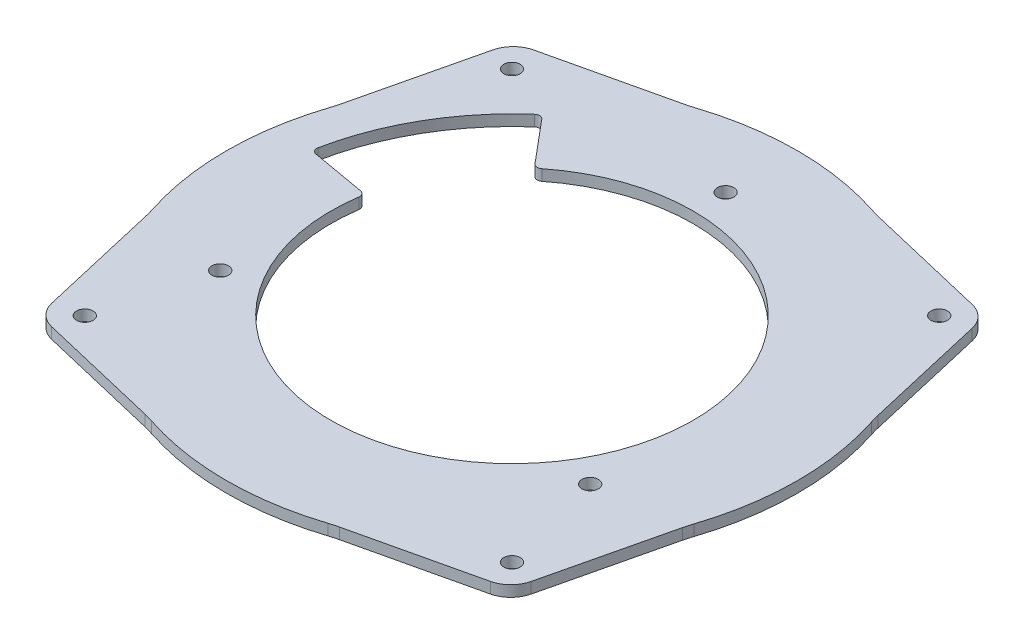
from build123d import *

# Parameters (mm, degrees)
SKETCH2_R           = 1.5
SKETCH2_R_2         = 33
BOSS_EXTRUDE1_DEPTH = 2
CUT_EXTRUDE1_DEPTH  = 74.566296631
FILLET1_R           = 1


with BuildPart() as part:
    # Sketch2 → Boss-Extrude1 (new body)
    with BuildSketch(Plane(origin=(0, 0, 0), x_dir=(1, 0, 0), z_dir=(0, 1, 0))):
        with BuildLine():
            Line((17.897079586, 48.929734976), (40.149284407, 43.651218265))
            ThreePointArc((40.149284407, 43.651218265), (42.540265174, 42.312242187), (43.866371506, 39.91409958))
            Line((43.866371506, 39.91409958), (49.02521675, 17.633846579))
            ThreePointArc((49.02521675, 17.633846579), (49.23478351, 16.809026698), (49.479249782, 15.993868858))
            ThreePointArc((49.479249782, 15.993868858), (51.999812242, -0.139738387), (49.392575566, -16.259565766))
            ThreePointArc((49.392575566, -16.259565766), (49.143731732, -17.073397941), (48.929734976, -17.897079586))
            Line((48.929734976, -17.897079586), (43.651218265, -40.149284407))
            ThreePointArc((43.651218265, -40.149284407), (42.312242187, -42.540265174), (39.91409958, -43.866371506))
            Line((39.91409958, -43.866371506), (17.633846579, -49.02521675))
            ThreePointArc((17.633846579, -49.02521675), (16.809026698, -49.23478351), (15.993868858, -49.479249782))
            ThreePointArc((15.993868858, -49.479249782), (-0.139738387, -51.999812242), (-16.259565766, -49.392575566))
            ThreePointArc((-16.259565766, -49.392575566), (-17.073397941, -49.143731732), (-17.897079586, -48.929734976))
            Line((-17.897079586, -48.929734976), (-40.149284407, -43.651218265))
            ThreePointArc((-40.149284407, -43.651218265), (-42.540265174, -42.312242187), (-43.866371506, -39.91409958))
            Line((-43.866371506, -39.91409958), (-49.02521675, -17.633846579))
            ThreePointArc((-49.02521675, -17.633846579), (-49.23478351, -16.809026698), (-49.479249782, -15.993868858))
            ThreePointArc((-49.479249782, -15.993868858), (-51.999812242, 0.139738387), (-49.392575566, 16.259565766))
            ThreePointArc((-49.392575566, 16.259565766), (-49.143731732, 17.073397941), (-48.929734976, 17.897079586))
            Line((-48.929734976, 17.897079586), (-43.651218265, 40.149284407))
            ThreePointArc((-43.651218265, 40.149284407), (-42.312242187, 42.540265174), (-39.91409958, 43.866371506))
            Line((-39.91409958, 43.866371506), (-17.633846579, 49.02521675))
            ThreePointArc((-17.633846579, 49.02521675), (-16.809026698, 49.23478351), (-15.993868858, 49.479249782))
            ThreePointArc((-15.993868858, 49.479249782), (-8.026622704, 51.3767781), (0.139738387, 51.999812242))
            ThreePointArc((0.139738387, 51.999812242), (8.302633013, 51.332896714), (16.259565766, 49.392575566))
            ThreePointArc((16.259565766, 49.392575566), (17.073397941, 49.143731732), (17.897079586, 48.929734976))
        make_face()
        with Locations(Location((-38.8907, 38.8907, 0), (0, 0, 270))):
            Circle(SKETCH2_R, mode=Mode.SUBTRACT)
        with Locations(Location((38.8907, 38.8907, 0), (0, 0, 90))):
            Circle(SKETCH2_R, mode=Mode.SUBTRACT)
        with Locations(Location((38.8907, -38.8907, 0), (0, 0, 270))):
            Circle(SKETCH2_R, mode=Mode.SUBTRACT)
        with Locations(Location((-38.8907, -38.8907, 0), (0, 0, 90))):
            Circle(SKETCH2_R, mode=Mode.SUBTRACT)
        with Locations(Location((0, 0, 0), (0, 0, 270))):
            Circle(SKETCH2_R_2, mode=Mode.SUBTRACT)
        with Locations(Location((0, 38.8907, 0), (0, 0, 270))):
            Circle(SKETCH2_R, mode=Mode.SUBTRACT)
        with Locations(Location((-33.680334171, -19.44535, 0), (0, 0, 270))):
            Circle(SKETCH2_R, mode=Mode.SUBTRACT)
        with Locations(Location((33.680334171, -19.44535, 0), (0, 0, 270))):
            Circle(SKETCH2_R, mode=Mode.SUBTRACT)
    extrude(amount=BOSS_EXTRUDE1_DEPTH)

    # Sketch3 → Cut-Extrude1 (cut, through all)
    with BuildSketch(Plane(origin=(0, 2, 0), x_dir=(1, 0, 0), z_dir=(0, 1, 0))):
        with BuildLine():
            Line((-21.21199112, 25.279466623), (-28.925442436, 34.47199994))
            ThreePointArc((-28.925442436, 34.47199994), (-38.97114317, 22.5), (-44.316348886, 7.814167995))
            Line((-44.316348886, 7.814167995), (-32.498655849, 5.730389863))
            ThreePointArc((-32.498655849, 5.730389863), (-28.578838325, 16.5), (-21.21199112, 25.279466623))
        make_face()
    extrude(amount=-CUT_EXTRUDE1_DEPTH, mode=Mode.SUBTRACT)

    # Fillet1
    fillet1_edges = [part.edges().sort_by_distance(p)[0] for p in [
        (-44.316348886, 1, -7.814167995),
        (-28.925442436, 1, -34.47199994),
        (-21.21199112, 1, -25.279466623),
        (-32.498655849, 1, -5.730389863),
    ]]
    fillet(fillet1_edges, radius=FILLET1_R)


solid = part.part
